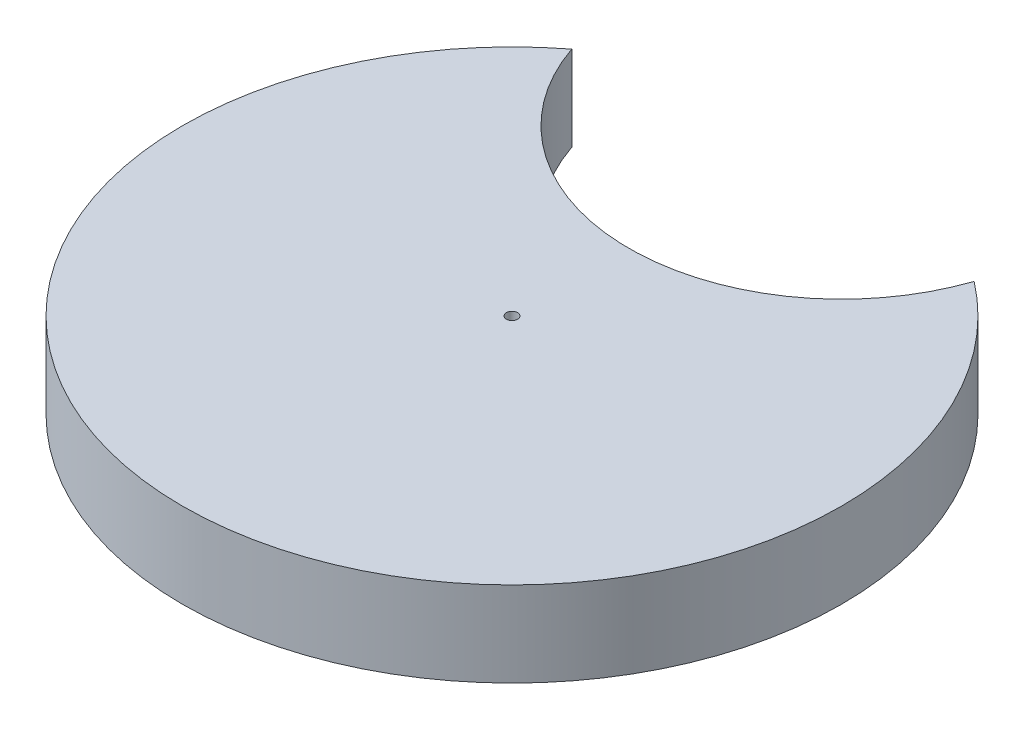
from build123d import *

# Parameters (mm, degrees)
BOSS_EXTRUDE1_DEPTH = 15
CUT_EXTRUDE1_DEPTH  = 10
SKETCH3_R           = 1
CUT_EXTRUDE2_DEPTH  = 10


with BuildPart() as part:
    # Sketch1 → Boss-Extrude1 (new body)
    with BuildSketch(Plane(origin=(0, 0, 0), x_dir=(1, 0, 0), z_dir=(0, 1, 0))):
        with BuildLine():
            ThreePointArc((-35.496119508, 46.04177293), (0, 20.636213797), (35.496119508, 46.04177293))
            ThreePointArc((35.496119508, 46.04177293), (0, -58.136213797), (-35.496119508, 46.04177293))
        make_face()
    extrude(amount=BOSS_EXTRUDE1_DEPTH)

    # Sketch2 → Cut-Extrude1 (cut)
    with BuildSketch(Plane.XZ):
        with BuildLine():
            Line((7.448979486, 1), (4.898979486, 1))
            ThreePointArc((4.898979486, 1), (-5, 0), (4.898979486, -1))
            Line((4.898979486, -1), (7.448979486, -1))
            Line((7.448979486, -1), (7.448979486, 1))
        make_face()
    extrude(amount=-CUT_EXTRUDE1_DEPTH, mode=Mode.SUBTRACT)

    # Sketch3 → Cut-Extrude2 (cut)
    with BuildSketch(Plane(origin=(0, 15, 0), x_dir=(1, 0, 0), z_dir=(0, 1, 0))):
        with Locations(Location((0, 0, 0), (0, 0, 270))):
            Circle(SKETCH3_R)
    extrude(amount=-CUT_EXTRUDE2_DEPTH, mode=Mode.SUBTRACT)


solid = part.part
